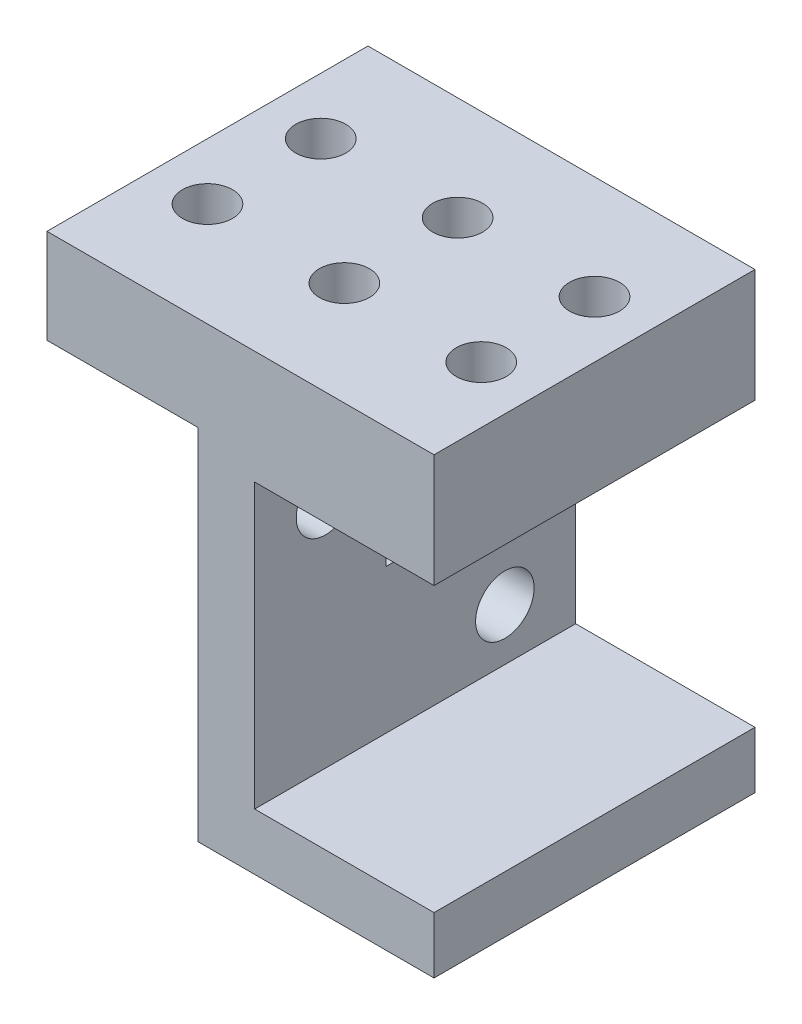
from build123d import *

# Parameters (mm, degrees)
BOSS_EXTRUDE1_DEPTH           = 17
F_3_0_3_DIAMETER_HOLE1_D      = 3.1
TAP_DRILL_FOR_M2_5_TAP1_D     = 2.65
TAP_DRILL_FOR_M2_5_TAP1_DEPTH = 4.3
SKETCH8_W                     = 9.2
SKETCH8_H                     = 6.5
CUT_EXTRUDE1_DEPTH            = 10
SKETCH9_W                     = 8
SKETCH9_H                     = 6
BOSS_EXTRUDE2_DEPTH           = 17
TAP_DRILL_FOR_M2_5_TAP2_D     = 2.65
TAP_DRILL_FOR_M2_5_TAP2_DEPTH = 4.3
SKETCH12_W                    = 8
SKETCH12_H                    = 1
CUT_EXTRUDE2_DEPTH            = 26


with BuildPart() as part:
    # Sketch1 → Boss-Extrude1 (new body)
    with BuildSketch(Plane.XY):
        Polygon((0, 2.988929889), (0, 0), (5, 0), (12.5, 0), (12.5, 3), (3, 3), (3, 18), (12.5, 18), (12.5, 24), (5, 24), (0, 24), (0, 17.988929889), align=None)
    extrude(amount=BOSS_EXTRUDE1_DEPTH)

    # Ø3.0 (3) Diameter Hole1 (through all)
    with Locations(Plane(origin=(3, 0, 0), x_dir=(0, 0, -1), z_dir=(1, 0, 0))):
        with Locations((-13.25, 15.25), (-3.75, 5.75)):
            Hole(F_3_0_3_DIAMETER_HOLE1_D / 2)

    # Tap Drill for M2.5 Tap1
    with Locations(Plane(origin=(0, 24, 0), x_dir=(1, 0, 0), z_dir=(0, 1, 0))):
        with Locations((2.25, -5.5), (2.25, -11.5), (9.5, -11.5), (9.5, -5.5)):
            Hole(TAP_DRILL_FOR_M2_5_TAP1_D / 2, depth=TAP_DRILL_FOR_M2_5_TAP1_DEPTH)

    # Sketch8 → Cut-Extrude1 (cut)
    with BuildSketch(Plane(origin=(3, 0, 0), x_dir=(0, 0, -1), z_dir=(1, 0, 0))):
        with Locations((-5.45, 13.9)):
            Rectangle(SKETCH8_W, SKETCH8_H)
    extrude(amount=-CUT_EXTRUDE1_DEPTH, mode=Mode.SUBTRACT)

    # Sketch9 → Boss-Extrude2 (add)
    with BuildSketch(Plane.XY.offset(17)):
        with Locations((-4, 21)):
            Rectangle(SKETCH9_W, SKETCH9_H)
    extrude(amount=-BOSS_EXTRUDE2_DEPTH)

    # Tap Drill for M2.5 Tap2
    with Locations(Plane(origin=(0, 24, 0), x_dir=(1, 0, 0), z_dir=(0, 1, 0))):
        with Locations((-5, -11.5), (-5, -5.5)):
            Hole(TAP_DRILL_FOR_M2_5_TAP2_D / 2, depth=TAP_DRILL_FOR_M2_5_TAP2_DEPTH)

    # Sketch12 → Cut-Extrude2 (cut)
    with BuildSketch(Plane.XY.offset(17)):
        with Locations((-4, 18.5)):
            Rectangle(SKETCH12_W, SKETCH12_H)
    extrude(amount=-CUT_EXTRUDE2_DEPTH, mode=Mode.SUBTRACT)


solid = part.part
